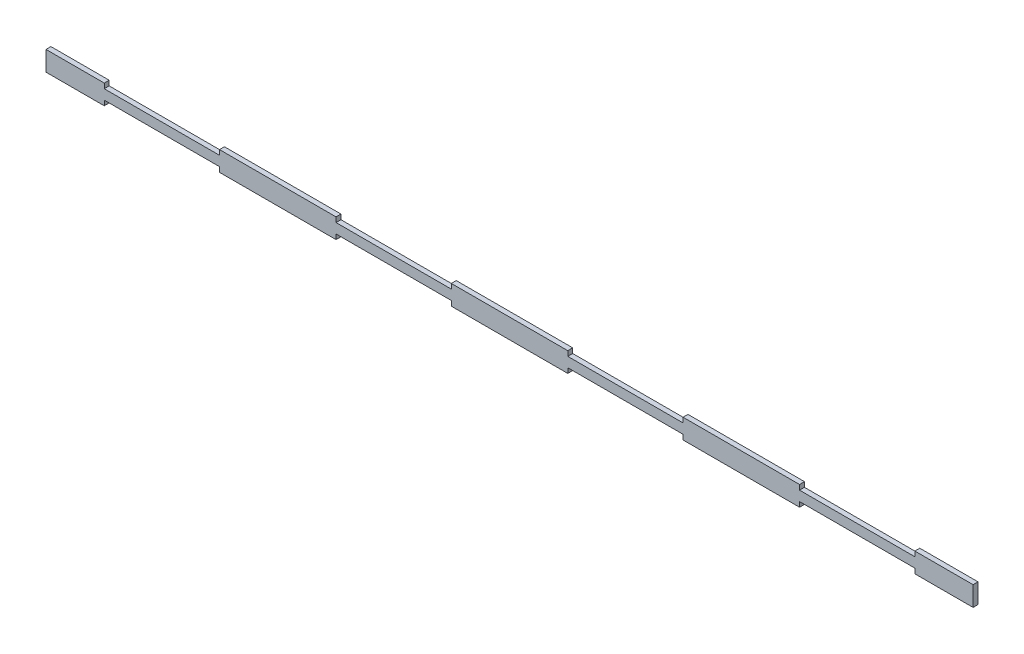
from build123d import *

# Parameters (mm, degrees)
BOSS_EXTRU_1_DEPTH = 3.175


with BuildPart() as part:
    # Esquisse1 → Boss.-Extru.1 (new body)
    with BuildSketch(Plane.XY):
        Polygon((298.45, -12.7), (298.45, 0), (260.94375, 0), (260.94375, -3.175), (186.73125, -3.175), (186.73125, 0), (111.71875, 0), (111.71875, -3.175), (37.50625, -3.175), (37.50625, 0), (-37.50625, 0), (-37.50625, -3.175), (-111.71875, -3.175), (-111.71875, 0), (-186.73125, 0), (-186.73125, -3.175), (-260.94375, -3.175), (-260.94375, 0), (-298.45, 0), (-298.45, -12.7), (-260.94375, -12.7), (-260.94375, -9.525), (-186.73125, -9.525), (-186.73125, -12.7), (-111.71875, -12.7), (-111.71875, -9.525), (-37.50625, -9.525), (-37.50625, -12.7), (37.50625, -12.7), (37.50625, -9.525), (111.71875, -9.525), (111.71875, -12.7), (186.73125, -12.7), (186.73125, -9.525), (260.94375, -9.525), (260.94375, -12.7), align=None)
    extrude(amount=-BOSS_EXTRU_1_DEPTH)


solid = part.part
